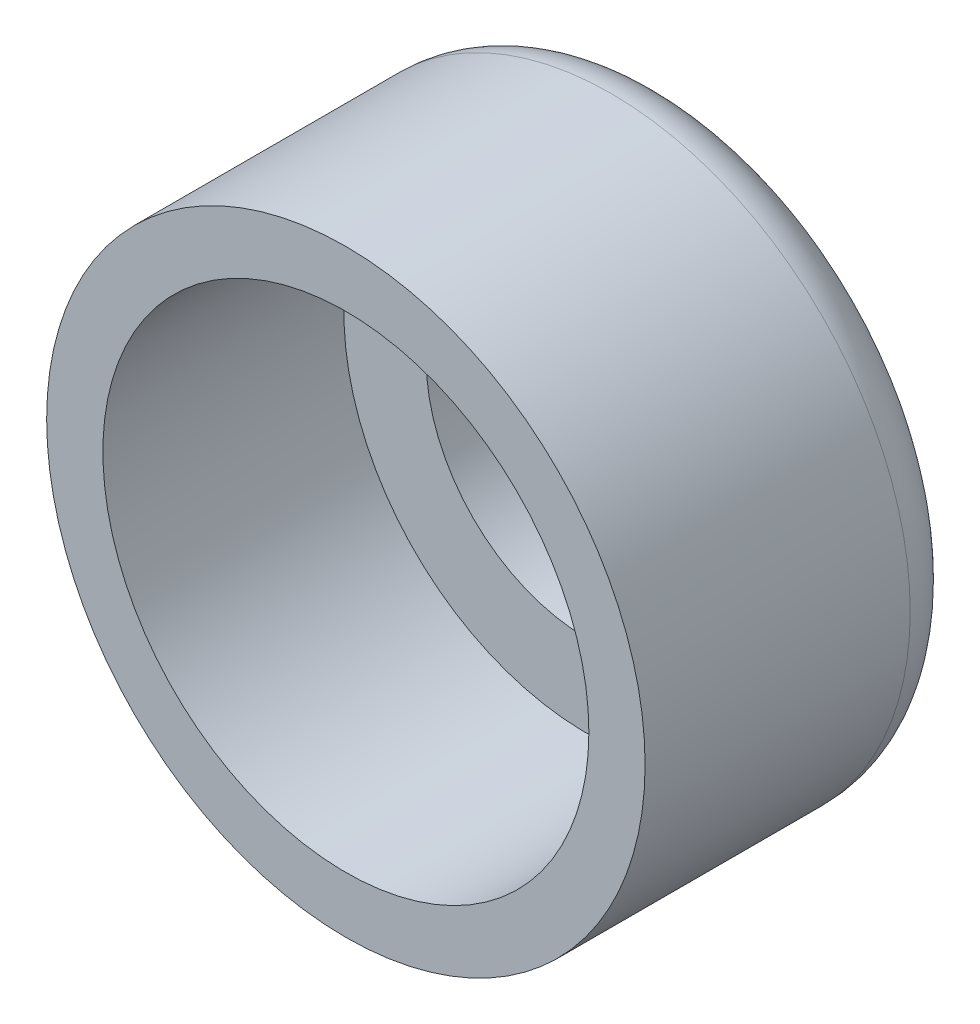
from build123d import *

# Parameters (mm, degrees)
SKETCH1_R           = 3.725
SKETCH1_R_2         = 2
BOSS_EXTRUDE1_DEPTH = 1
SKETCH2_R           = 3.725
SKETCH2_R_2         = 3.025
BOSS_EXTRUDE2_DEPTH = 3
FILLET1_R           = 0.7


with BuildPart() as part:
    # Sketch1 → Boss-Extrude1 (new body)
    with BuildSketch(Plane(origin=(0, 0, 0), x_dir=(0, 1, 0), z_dir=(0, 0, 1))):
        with Locations(Location((0, 0, 0), (0, 0, 270))):
            Circle(SKETCH1_R)
        with Locations(Location((0, 0, 0), (0, 0, 270))):
            Circle(SKETCH1_R_2, mode=Mode.SUBTRACT)
    extrude(amount=BOSS_EXTRUDE1_DEPTH)

    # Sketch2 → Boss-Extrude2 (add)
    with BuildSketch(Plane.XY.offset(1)):
        Circle(SKETCH2_R)
        Circle(SKETCH2_R_2, mode=Mode.SUBTRACT)
    extrude(amount=BOSS_EXTRUDE2_DEPTH)

    # Fillet1
    fillet1_edges = [part.edges().sort_by_distance(p)[0] for p in [
        (-3.725, 0, 0),
    ]]
    fillet(fillet1_edges, radius=FILLET1_R)


solid = part.part
